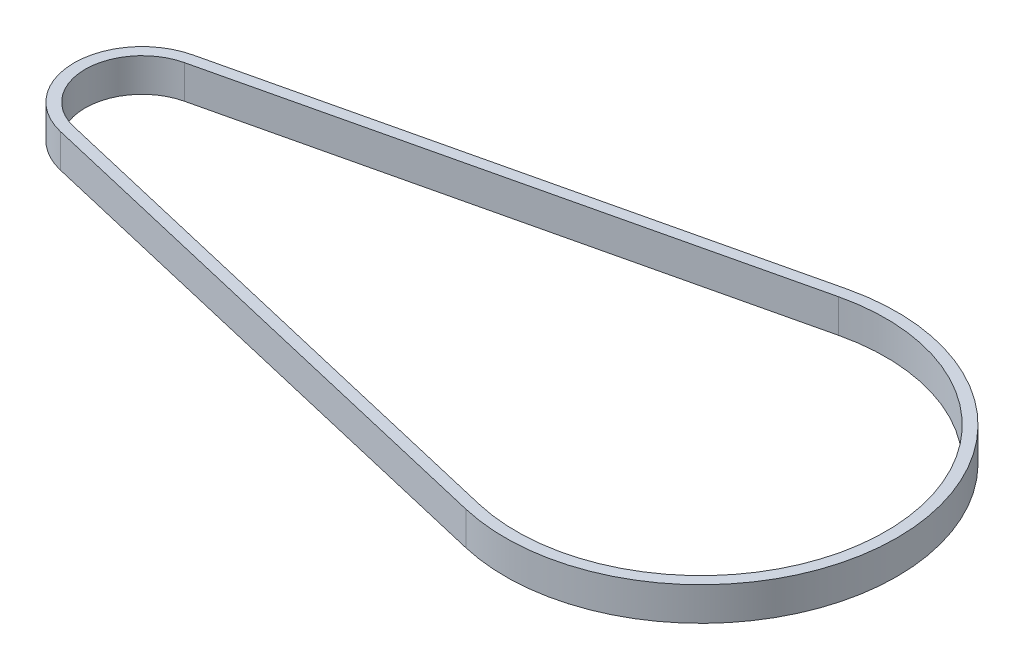
from build123d import *

# Parameters (mm, degrees)
BOSS_EXTRUDE1_DEPTH = 3


with BuildPart() as part:
    # Sketch1 → Boss-Extrude1 (new body)
    with BuildSketch(Plane(origin=(0, 0, 0), x_dir=(1, 0, 0), z_dir=(0, 1, 0))):
        with BuildLine():
            Line((-51.513944323, 5.938689559), (-4.009295632, 17.085902041))
            ThreePointArc((-4.009295632, 17.085902041), (17.55, 0), (-4.009295632, -17.085902041))
            Line((-4.009295632, -17.085902041), (-51.513944323, -5.938689559))
            ThreePointArc((-51.513944323, -5.938689559), (-56.220399942, 0), (-51.513944323, 5.938689559))
        make_face()
        with BuildLine():
            Line((-51.28549443, 4.965133887), (-3.780845738, 16.112346369))
            ThreePointArc((-3.780845738, 16.112346369), (16.55, 0), (-3.780845738, -16.112346369))
            Line((-3.780845738, -16.112346369), (-51.28549443, -4.965133887))
            ThreePointArc((-51.28549443, -4.965133887), (-55.220399942, 0), (-51.28549443, 4.965133887))
        make_face(mode=Mode.SUBTRACT)
    extrude(amount=BOSS_EXTRUDE1_DEPTH)


solid = part.part
